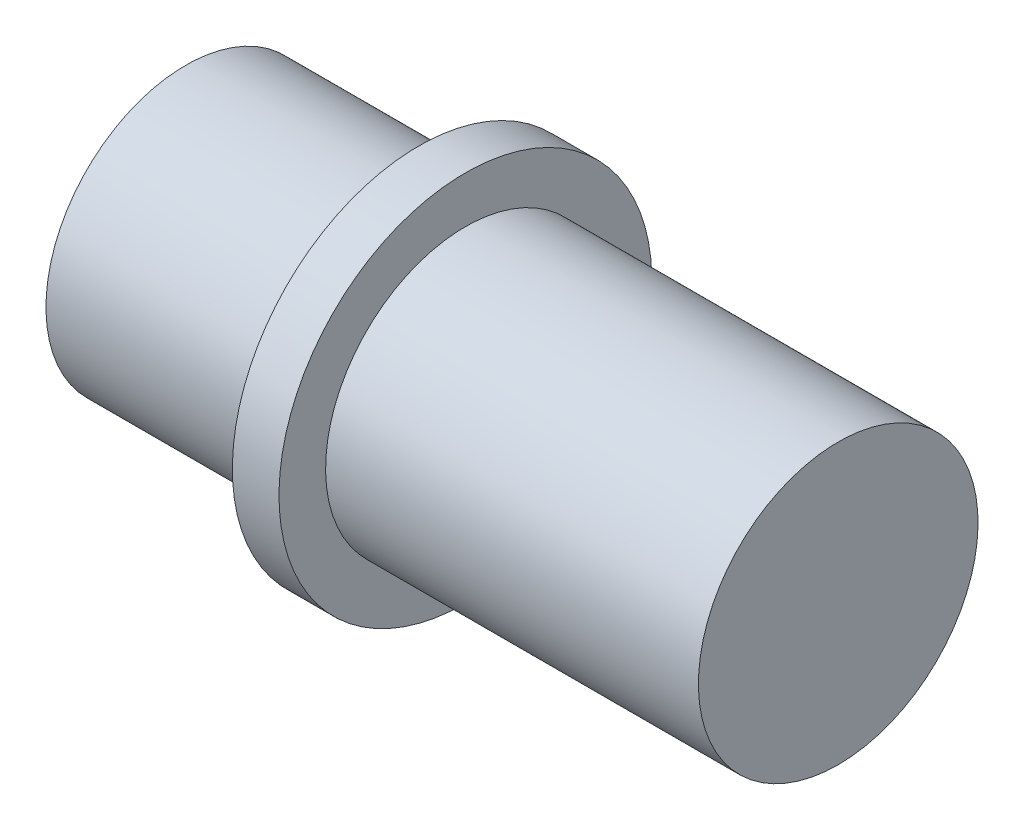
from build123d import *

# Parameters (mm, degrees)
CUT_EXTRUDE1_DEPTH = 1.8


with BuildPart() as part:
    # Sketch1 → Revolve1 (revolve)
    with BuildSketch(Plane.XY, mode=Mode.PRIVATE) as revolve1_sk:
        Polygon((0, 0), (0, 3), (5, 3), (5, 4), (6, 4), (6, 3), (14, 3), (14, 0), align=None)
    revolve(revolve1_sk.sketch.rotate(Axis((0, 0, 0), (1, 0, 0)), 180), axis=Axis((0, 0, 0), (1, 0, 0)))

    # Sketch2 → Cut-Revolve1 (revolve, cut)
    with BuildSketch(Plane.XY, mode=Mode.PRIVATE) as cut_revolve1_sk:
        Polygon((0, 0), (0, 1.5), (1.8, 1.5), (2.666025404, 0), align=None)
    revolve(cut_revolve1_sk.sketch.rotate(Axis((0, 0, 0), (1, 0, 0)), 90), axis=Axis((0, 0, 0), (1, 0, 0)), mode=Mode.SUBTRACT)

    # Sketch3 → Cut-Extrude1 (cut)
    with BuildSketch(Plane.ZY):
        Polygon((0, 1.732050808), (-1.5, 0.866025404), (-1.5, -0.866025404), (0, -1.732050808), (1.5, -0.866025404), (1.5, 0.866025404), align=None)
    extrude(amount=-CUT_EXTRUDE1_DEPTH, mode=Mode.SUBTRACT)


solid = part.part
